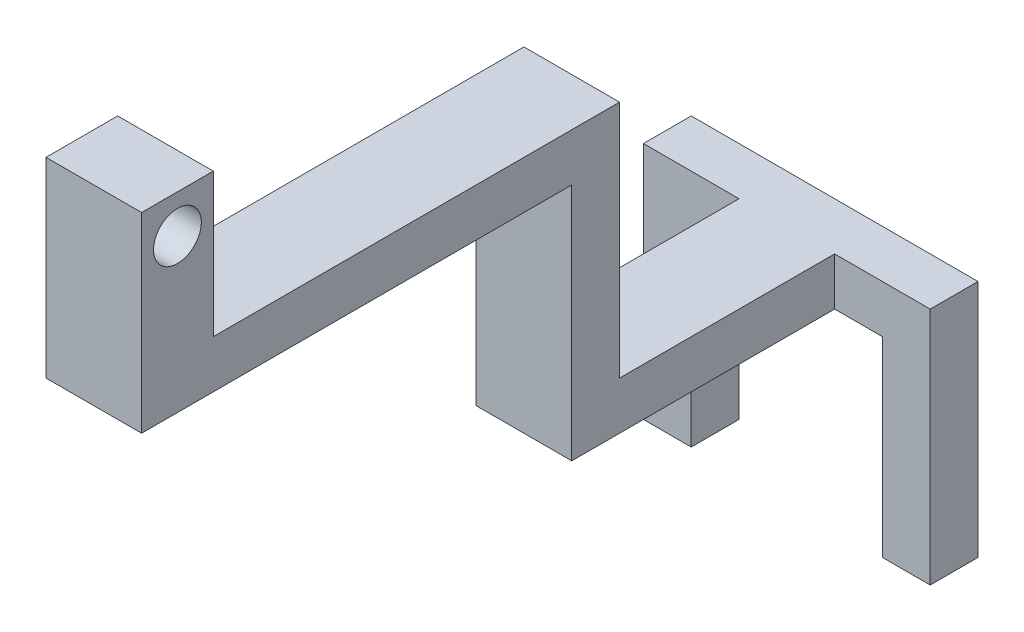
from build123d import *

# Parameters (mm, degrees)
P_IDAT_VYSUNUT_M1_DEPTH  = 10
SKICA2_W                 = 20
SKICA2_H                 = 10
P_IDAT_VYSUNUT_M2_DEPTH  = 55
SKICA4_W                 = 20
SKICA4_H                 = 10
P_IDAT_VYSUNUT_M3_DEPTH  = 50
SKICA5_W                 = 20
SKICA5_H                 = 10
P_IDAT_VYSUNUT_M4_DEPTH  = 90
SKICA6_W                 = 20
SKICA6_H                 = 15
P_IDAT_VYSUNUT_M5_DEPTH  = 30
SKICA7_R                 = 5
ODEBRAT_VYSUNUT_M1_DEPTH = 20


with BuildPart() as part:
    # Skica1 → Přidat vysunutím1 (new body)
    with BuildSketch(Plane.XY):
        Polygon((0, 0), (60, 0), (60, -50), (50, -50), (50, -10), (10, -10), (10, -50), (0, -50), align=None)
    extrude(amount=P_IDAT_VYSUNUT_M1_DEPTH)

    # Skica2 → Přidat vysunutím2 (add)
    with BuildSketch(Plane.XY.offset(10)):
        with Locations((30, -5)):
            Rectangle(SKICA2_W, SKICA2_H)
    extrude(amount=P_IDAT_VYSUNUT_M2_DEPTH)

    # Skica4 → Přidat vysunutím3 (add)
    with BuildSketch(Plane(origin=(0, 0, 0), x_dir=(1, 0, 0), z_dir=(0, 1, 0))):
        with Locations((30, -60)):
            Rectangle(SKICA4_W, SKICA4_H)
    extrude(amount=P_IDAT_VYSUNUT_M3_DEPTH)

    # Skica5 → Přidat vysunutím4 (add)
    with BuildSketch(Plane.XY.offset(65)):
        with Locations((30, 45)):
            Rectangle(SKICA5_W, SKICA5_H)
    extrude(amount=P_IDAT_VYSUNUT_M4_DEPTH)

    # Skica6 → Přidat vysunutím5 (add)
    with BuildSketch(Plane(origin=(0, 50, 0), x_dir=(1, 0, 0), z_dir=(0, 1, 0))):
        with Locations((30, -147.5)):
            Rectangle(SKICA6_W, SKICA6_H)
    extrude(amount=P_IDAT_VYSUNUT_M5_DEPTH)

    # Skica7 → Odebrat vysunutím1 (cut)
    with BuildSketch(Plane(origin=(40, 0, 0), x_dir=(0, 0, -1), z_dir=(1, 0, 0))):
        with Locations((-147.5, 72)):
            Circle(SKICA7_R)
    extrude(amount=-ODEBRAT_VYSUNUT_M1_DEPTH, mode=Mode.SUBTRACT)


solid = part.part
